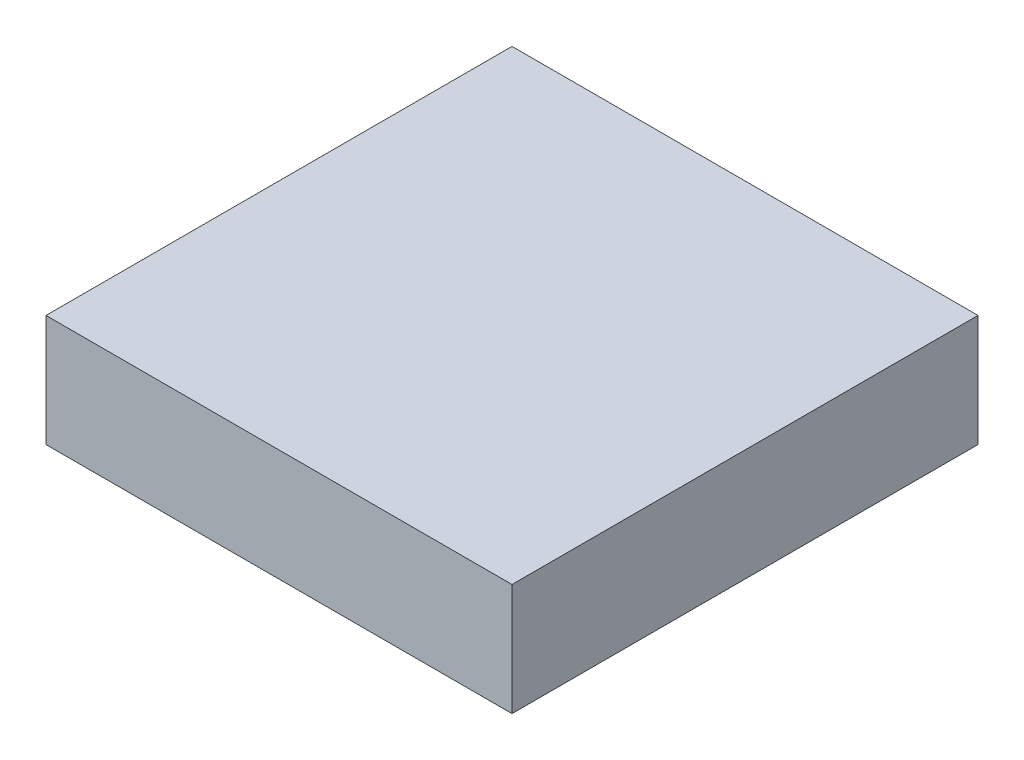
from build123d import *

# Parameters (mm, degrees)
SKETCH1_W          = 50
SKETCH1_H          = 12
BASE_EXTRUDE_DEPTH = 50


with BuildPart() as part:
    # Sketch1 → Base-Extrude (new body)
    with BuildSketch(Plane.XY):
        with Locations((25, 6)):
            Rectangle(SKETCH1_W, SKETCH1_H)
    extrude(amount=-BASE_EXTRUDE_DEPTH)


solid = part.part
